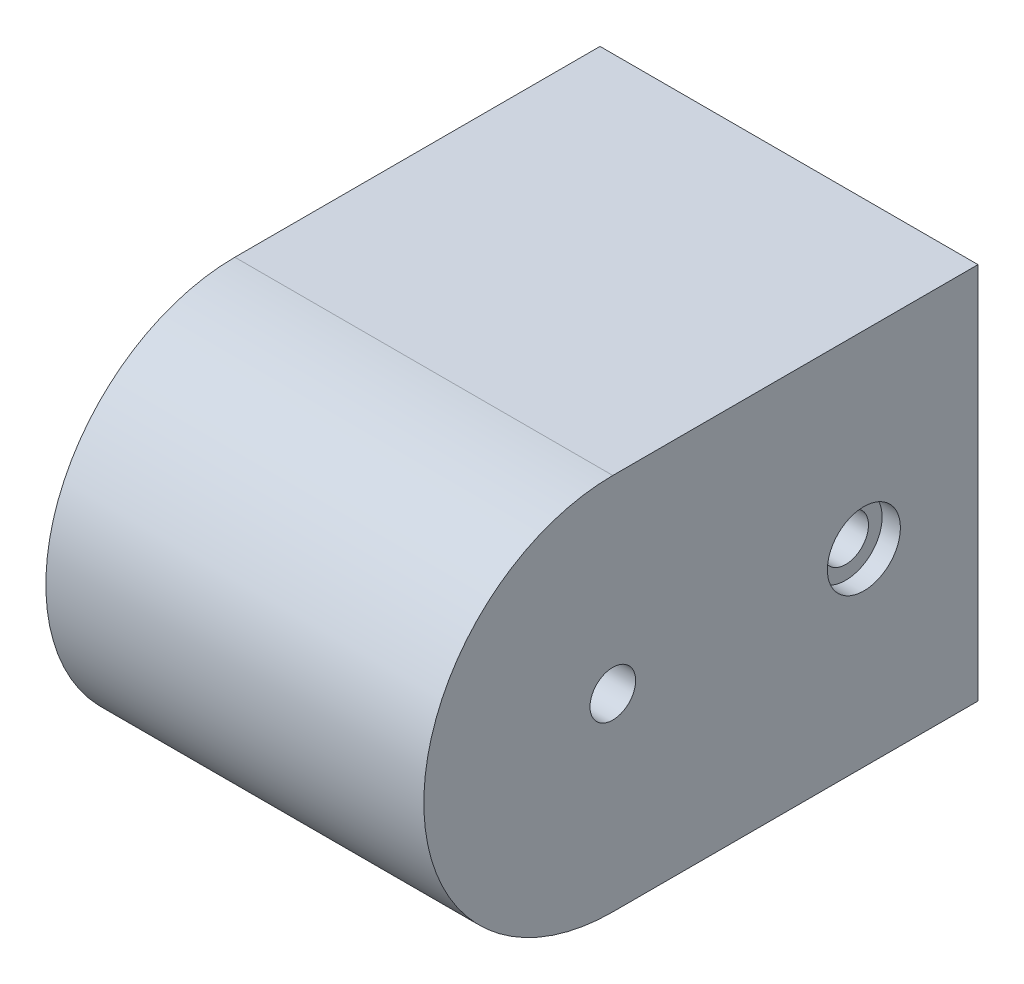
from build123d import *

# Parameters (mm, degrees)
SKETCH1_W           = 41.4
SKETCH1_H           = 41.4
SKETCH1_W_2         = 25.4
SKETCH1_H_2         = 25.4
BOSS_EXTRUDE1_DEPTH = 30
SKETCH2_W           = 41.4
SKETCH2_H           = 41.4
BOSS_EXTRUDE2_DEPTH = 10
BOSS_EXTRUDE3_DEPTH = 41.4
SKETCH4_R           = 2.5
CUT_EXTRUDE1_DEPTH  = 41.4
CUT_EXTRUDE2_REACH  = 78.334
SKETCH5_R           = 2.5
SKETCH6_R           = 4
CUT_EXTRUDE3_DEPTH  = 2
CUT_EXTRUDE4_START  = -2
SKETCH7_R           = 4
CUT_EXTRUDE4_DEPTH  = 2


with BuildPart() as part:
    # Sketch1 → Boss-Extrude1 (new body)
    with BuildSketch(Plane.XY):
        Rectangle(SKETCH1_W, SKETCH1_H)
        Rectangle(SKETCH1_W_2, SKETCH1_H_2, mode=Mode.SUBTRACT)
    extrude(amount=BOSS_EXTRUDE1_DEPTH)

    # Sketch2 → Boss-Extrude2 (add)
    with BuildSketch(Plane.XY.offset(30)):
        Rectangle(SKETCH2_W, SKETCH2_H)
    extrude(amount=BOSS_EXTRUDE2_DEPTH)

    # Sketch3 → Boss-Extrude3 (add)
    with BuildSketch(Plane(origin=(20.7, 0, 0), x_dir=(0, 0, -1), z_dir=(1, 0, 0))):
        with BuildLine():
            Line((-40, -20.7), (-40, 20.7))
            ThreePointArc((-40, 20.7), (-60.7, 0), (-40, -20.7))
        make_face()
    extrude(amount=-BOSS_EXTRUDE3_DEPTH)

    # Sketch4 → Cut-Extrude1 (cut)
    with BuildSketch(Plane(origin=(20.7, 0, 0), x_dir=(0, 0, -1), z_dir=(1, 0, 0))):
        with Locations((-40, 0)):
            Circle(SKETCH4_R)
    extrude(amount=-CUT_EXTRUDE1_DEPTH, mode=Mode.SUBTRACT)

    # Cut-Extrude2: up to this face of the body (flat: up to its plane)
    cut_extrude2_end = Plane(part.part.faces().sort_by_distance((20.7, 0, 28.219269494))[0])
    # Sketch5 → Cut-Extrude2 (cut, up to the picked face)
    with BuildSketch(Plane.ZY.offset(20.7), mode=Mode.PRIVATE) as cut_extrude2_sk1:
        with Locations((12.5, 0)):
            Circle(SKETCH5_R)
    cut_extrude2_tool1 = split(extrude(cut_extrude2_sk1.sketch, amount=-CUT_EXTRUDE2_REACH, mode=Mode.PRIVATE), bisect_by=cut_extrude2_end, keep=Keep.BOTH, mode=Mode.PRIVATE)
    add(cut_extrude2_tool1.solids().sort_by(Axis((-20.7, 0, 12.5), (1, 0, 0)))[0], mode=Mode.SUBTRACT)

    # Sketch6 → Cut-Extrude3 (cut)
    with BuildSketch(Plane.ZY.offset(20.7)):
        with Locations((12.5, 0)):
            Circle(SKETCH6_R)
    extrude(amount=-CUT_EXTRUDE3_DEPTH, mode=Mode.SUBTRACT)

    # Sketch7 → Cut-Extrude4 (cut)
    with BuildSketch(Plane(origin=(20.7, 0, 0), x_dir=(0, 0, -1), z_dir=(1, 0, 0)).offset(CUT_EXTRUDE4_START)):
        with Locations(Location((-12.5, 0, 0), (0, 0, 180))):
            Circle(SKETCH7_R)
    extrude(amount=CUT_EXTRUDE4_DEPTH, mode=Mode.SUBTRACT)


solid = part.part
